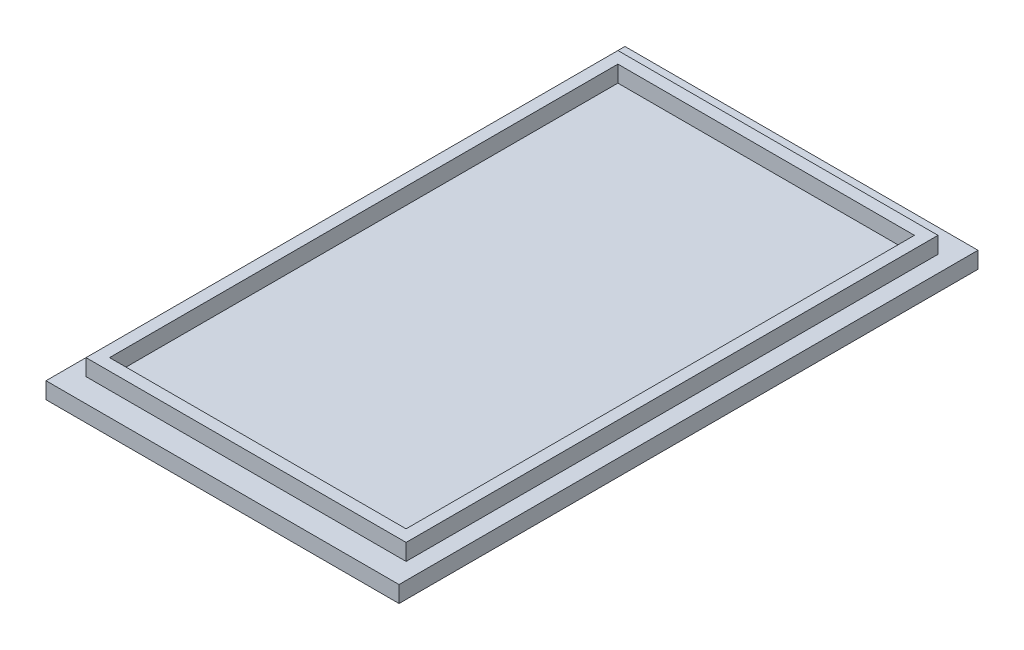
from build123d import *

# Parameters (mm, degrees)
SKETCH1_W           = 37.5
SKETCH1_H           = 61.5
BOSS_EXTRUDE1_DEPTH = 1.75
SKETCH2_W           = 34
SKETCH2_H           = 56.5
BOSS_EXTRUDE2_DEPTH = 1.75
SKETCH3_W           = 31.5
SKETCH3_H           = 54
CUT_EXTRUDE1_DEPTH  = 1.75


with BuildPart() as part:
    # Sketch1 → Boss-Extrude1 (new body)
    with BuildSketch(Plane(origin=(0, 0, 0), x_dir=(1, 0, 0), z_dir=(0, 1, 0))):
        with Locations((-156.892564619, -93.318616843)):
            Rectangle(SKETCH1_W, SKETCH1_H)
    extrude(amount=BOSS_EXTRUDE1_DEPTH)

    # Sketch2 → Boss-Extrude2 (add)
    with BuildSketch(Plane(origin=(0, 1.75, 0), x_dir=(1, 0, 0), z_dir=(0, 1, 0))):
        with Locations((-156.892564619, -93.318616843)):
            Rectangle(SKETCH2_W, SKETCH2_H)
    extrude(amount=BOSS_EXTRUDE2_DEPTH)

    # Sketch3 → Cut-Extrude1 (cut)
    with BuildSketch(Plane(origin=(0, 3.5, 0), x_dir=(1, 0, 0), z_dir=(0, 1, 0))):
        with Locations((-156.892564619, -93.318616843)):
            Rectangle(SKETCH3_W, SKETCH3_H)
    extrude(amount=-CUT_EXTRUDE1_DEPTH, mode=Mode.SUBTRACT)


solid = part.part
